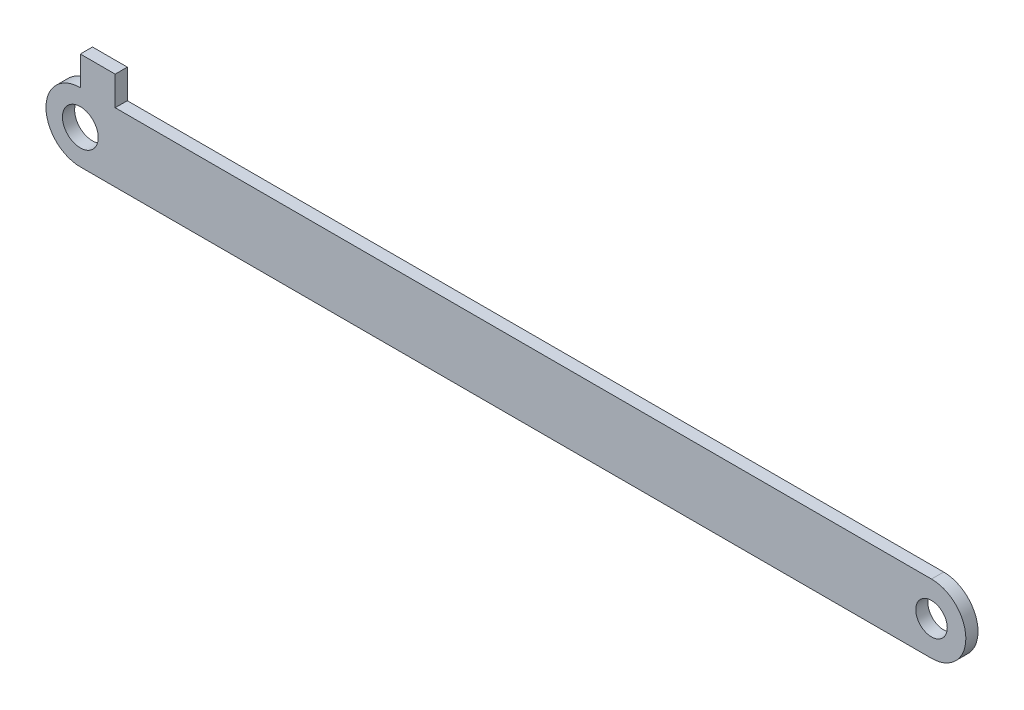
from build123d import *

# Parameters (mm, degrees)
SKETCH_1_R      = 7.352953784
SKETCH_1_R_2    = 6.485613762
EXTRUDE_1_DEPTH = 5
SKETCH_2_W      = 14.323977173
SKETCH_2_H      = 11.973415737
EXTRUDE_2_DEPTH = 5


with BuildPart() as part:
    # 草图1 → 凸台-拉伸1 (new body)
    with BuildSketch(Plane.XY):
        with BuildLine():
            Line((0, 14.12037037), (350, 14.12037037))
            ThreePointArc((350, 14.12037037), (364.12037037, 0), (350, -14.12037037))
            Line((350, -14.12037037), (0, -14.12037037))
            ThreePointArc((0, -14.12037037), (-14.12037037, 0), (0, 14.12037037))
        make_face()
        Circle(SKETCH_1_R, mode=Mode.SUBTRACT)
        with Locations((350, 0)):
            Circle(SKETCH_1_R_2, mode=Mode.SUBTRACT)
    extrude(amount=EXTRUDE_1_DEPTH)

    # 草图2 → 凸台-拉伸2 (add)
    with BuildSketch(Plane.XY):
        with Locations((7.161988587, 20.107078239)):
            Rectangle(SKETCH_2_W, SKETCH_2_H)
    extrude(amount=EXTRUDE_2_DEPTH)


solid = part.part
